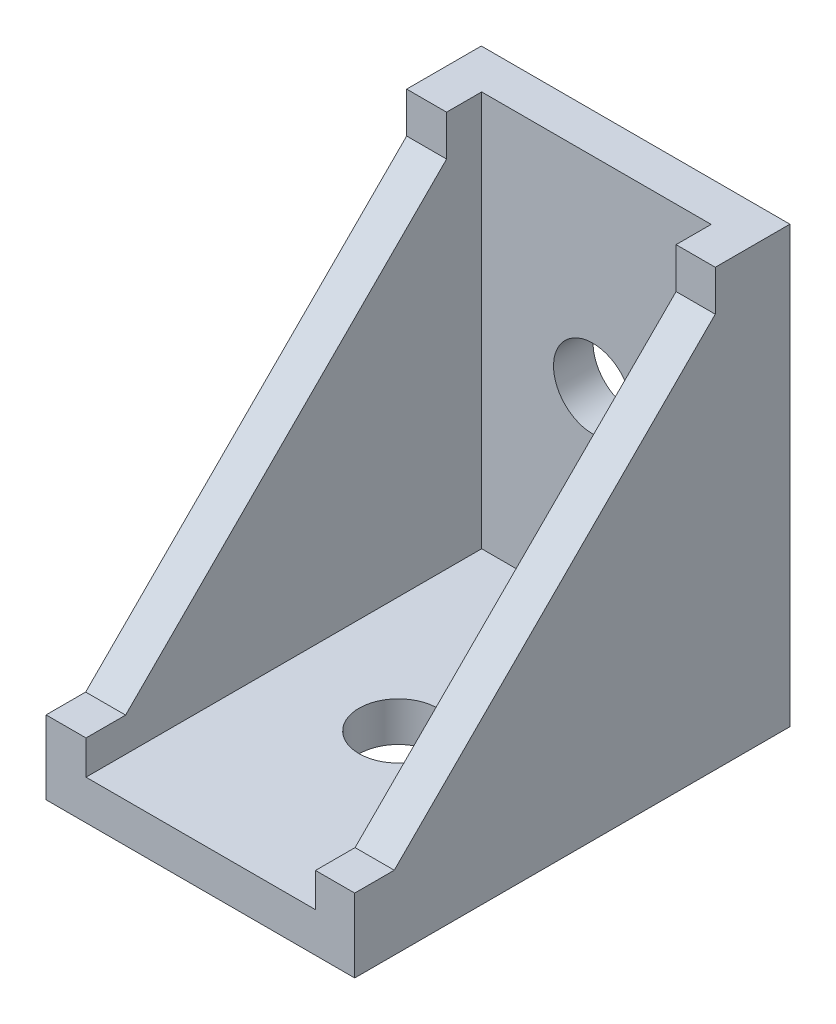
from build123d import *

# Parameters (mm, degrees)
SKETCH1_W                  = 19.812
SKETCH1_H                  = 27.94
BOSS_EXTRUDE1_DEPTH        = 27.94
SKETCH2_W                  = 14.732
SKETCH2_H                  = 25.4
CUT_EXTRUDE2_DEPTH         = 25.4
CUT_EXTRUDE3_DEPTH         = 45.201838695
CUT_EXTRUDE3_DEPTH_BACK    = 45.201838695
F_8_0_199_DIAMETER_HOLE1_D = 5.0546
F_8_0_199_DIAMETER_HOLE2_D = 5.0546


with BuildPart() as part:
    # Sketch1 → Boss-Extrude1 (new body)
    with BuildSketch(Plane.XY):
        with Locations((9.906, -13.97)):
            Rectangle(SKETCH1_W, SKETCH1_H)
    extrude(amount=BOSS_EXTRUDE1_DEPTH)

    # Sketch2 → Cut-Extrude2 (cut)
    with BuildSketch(Plane.XY.offset(27.94)):
        with Locations((9.92950186, -12.7)):
            Rectangle(SKETCH2_W, SKETCH2_H)
    extrude(amount=-CUT_EXTRUDE2_DEPTH, mode=Mode.SUBTRACT)

    # Sketch3 → Cut-Extrude3 (cut, two sides: drawn at the far end of the back side and taken through both)
    with BuildSketch(Plane(origin=(19.812, 0, 0), x_dir=(0, 0, -1), z_dir=(1, 0, 0)).offset(-CUT_EXTRUDE3_DEPTH_BACK)):
        Polygon((-27.94, 89.026253865), (-27.94, 0), (-27.94, -23.217666002), (-25.4, -23.217666002), (-4.791969325, -2.609635327), (-4.791969325, 0), (-4.791969325, 89.026253865), (-4.791969325, 267.078761596), (-27.94, 267.078761596), align=None)
    extrude(amount=CUT_EXTRUDE3_DEPTH + CUT_EXTRUDE3_DEPTH_BACK, mode=Mode.SUBTRACT)

    # #8 (0.199) Diameter Hole1 (through all)
    with Locations(Plane(origin=(0, -25.4, 0), x_dir=(1, 0, 0), z_dir=(0, 1, 0))):
        with Locations((10.016640072, -15.343780892)):
            Hole(F_8_0_199_DIAMETER_HOLE1_D / 2)

    # #8 (0.199) Diameter Hole2 (through all)
    with Locations(Plane.XY.offset(2.54)):
        with Locations((9.703159868, -12.928139324)):
            Hole(F_8_0_199_DIAMETER_HOLE2_D / 2)


solid = part.part
